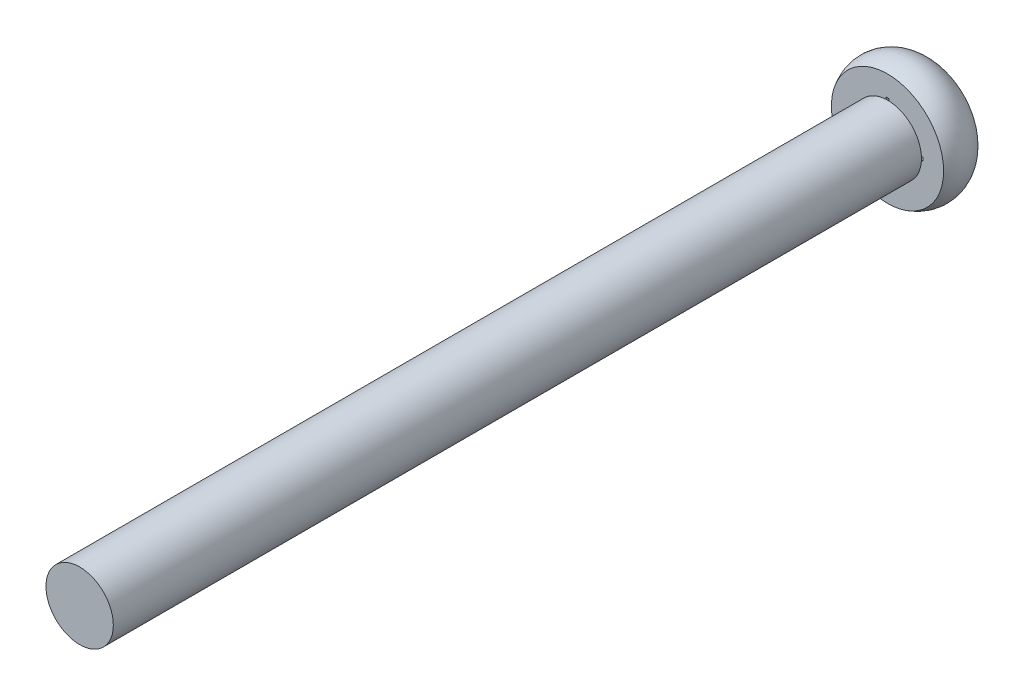
from build123d import *

# Parameters (mm, degrees)
CUT_EXTRUDE1_DEPTH  = 2
CUT_EXTRUDE1_DRAFT  = -12
SKETCH3_R           = 1.5
BOSS_EXTRUDE1_DEPTH = 36


with BuildPart() as part:
    # Sketch1 → Revolve2 (revolve)
    with BuildSketch(Plane(origin=(0, 0, 0), x_dir=(1, 0, 0), z_dir=(0, 1, 0))):
        with BuildLine():
            Line((0, 0), (0, 2))
            Line((0, 2), (1.798285661, 2))
            ThreePointArc((1.798285661, 2), (1.941964308, 1.978911731), (2.07352322, 1.917425786))
            ThreePointArc((2.07352322, 1.917425786), (2.674697589, 1.044998208), (2.5, 0))
            Line((2.5, 0), (0, 0))
        make_face()
    revolve(axis=Axis((0, 0, -0.65925001), (0, 0, -1)))


with BuildPart() as cut_extrude1_tool:
    # Sketch2 → Cut-Extrude1 (with draft: the straight prism first)
    with BuildSketch(Plane(origin=(0, 0, -2), x_dir=(-1, 0, 0), z_dir=(0, 0, -1))):
        Polygon((0.5, -0.5), (2, -0.5), (2, 0.5), (0.5, 0.5), (0.5, 2), (-0.5, 2), (-0.5, 0.5), (-2, 0.5), (-2, -0.5), (-0.5, -0.5), (-0.5, -2), (0.5, -2), align=None)
    extrude(amount=-CUT_EXTRUDE1_DEPTH)
    # Cut-Extrude1: the draft: its side faces are tilted about the plane it starts from
    cut_extrude1_sides = [cut_extrude1_tool.faces().sort_by_distance(p)[0] for p in [
        (-1.25, -0.5, -1),
        (-2, 0, -1),
        (-1.25, 0.5, -1),
        (-0.5, 1.25, -1),
        (0, 2, -1),
        (0.5, 1.25, -1),
        (1.25, 0.5, -1),
        (2, 0, -1),
        (1.25, -0.5, -1),
        (0.5, -1.25, -1),
        (0, -2, -1),
        (-0.5, -1.25, -1),
    ]]
    draft(cut_extrude1_sides, Plane(origin=(0, 0, -2), x_dir=(-1, 0, 0), z_dir=(0, 0, -1)), CUT_EXTRUDE1_DRAFT)


with BuildPart() as part_1:
    add(part.part)

    # Cut-Extrude1: cut by cut_extrude1_tool
    add(cut_extrude1_tool.part, mode=Mode.SUBTRACT)

    # Sketch3 → Boss-Extrude1 (add)
    with BuildSketch(Plane.XY):
        with Locations(Location((0.013589602, -0.013589602, 0), (0, 0, 182.342035556))):
            Circle(SKETCH3_R)
    extrude(amount=BOSS_EXTRUDE1_DEPTH)


solid = part_1.part
